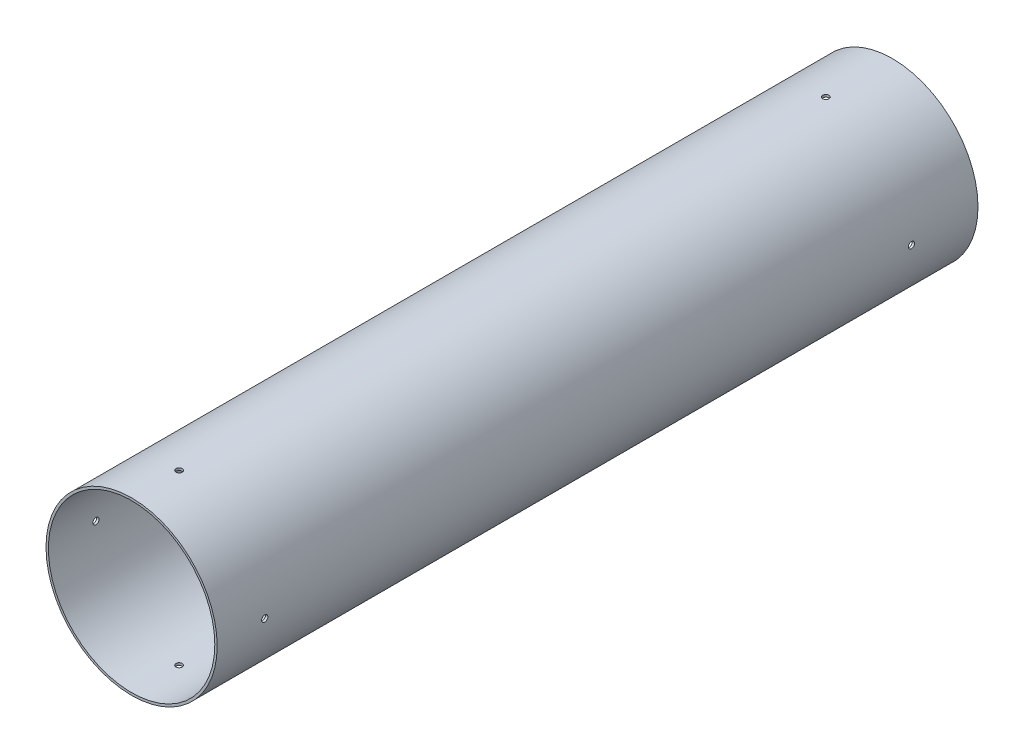
from build123d import *

# Parameters (mm, degrees)
SKETCH1_R           = 45
SKETCH1_R_2         = 43.75
BOSS_EXTRUDE1_DEPTH = 400
SKETCH2_R           = 1.65
CUT_EXTRUDE1_DEPTH  = 406.030863022
CIRPATTERN1_COUNT   = 4


with BuildPart() as part:
    # Sketch1 → Boss-Extrude1 (new body)
    with BuildSketch(Plane.XY):
        Circle(SKETCH1_R)
        Circle(SKETCH1_R_2, mode=Mode.SUBTRACT)
    extrude(amount=BOSS_EXTRUDE1_DEPTH)

    # Sketch2 → Cut-Extrude1 (cut, through all)
    with BuildSketch(Plane(origin=(0, 0, 0), x_dir=(0, 0, -1), z_dir=(1, 0, 0))):
        with Locations((-35, 0)):
            Circle(SKETCH2_R)
        with Locations((-375, 0)):
            Circle(SKETCH2_R)
    cut_extrude1 = extrude(amount=-CUT_EXTRUDE1_DEPTH, mode=Mode.SUBTRACT)

    # CirPattern1: Cut-Extrude1 ×4 about axis
    cirpattern1_axis = Axis((0, 0, 400), (0, 0, -1))
    for i in range(1, CIRPATTERN1_COUNT):
        add(cut_extrude1.rotate(cirpattern1_axis, i * 360 / CIRPATTERN1_COUNT), mode=Mode.SUBTRACT)


solid = part.part
